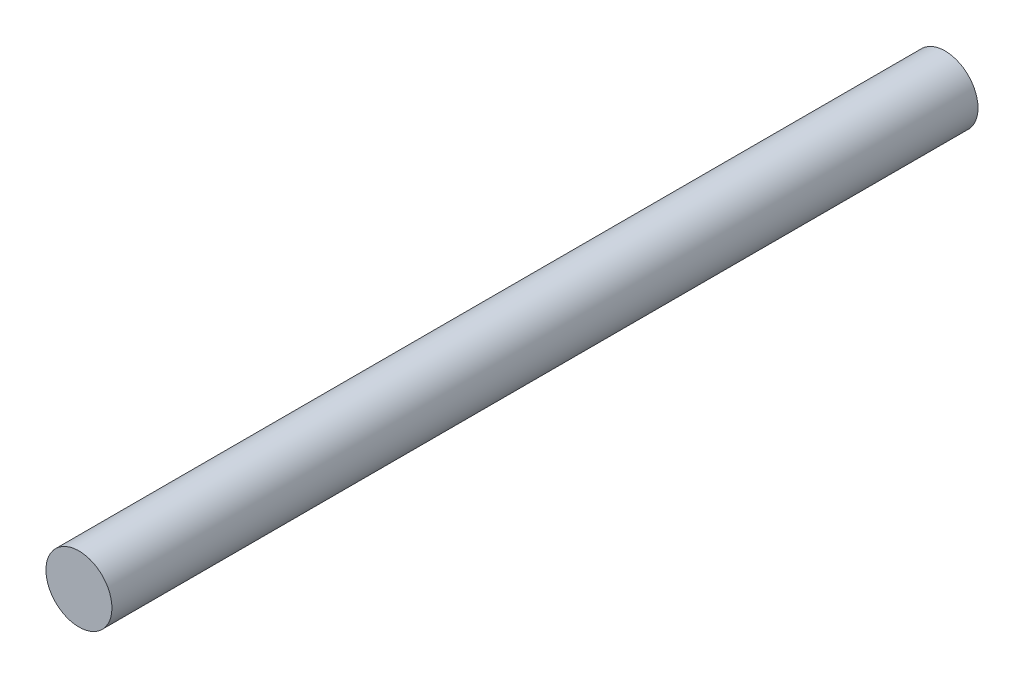
from build123d import *

# Parameters (mm, degrees)
SKETCH1_R           = 4
BOSS_EXTRUDE1_DEPTH = 105


with BuildPart() as part:
    # Sketch1 → Boss-Extrude1 (new body)
    with BuildSketch(Plane.XY):
        Circle(SKETCH1_R)
    extrude(amount=BOSS_EXTRUDE1_DEPTH)


solid = part.part
